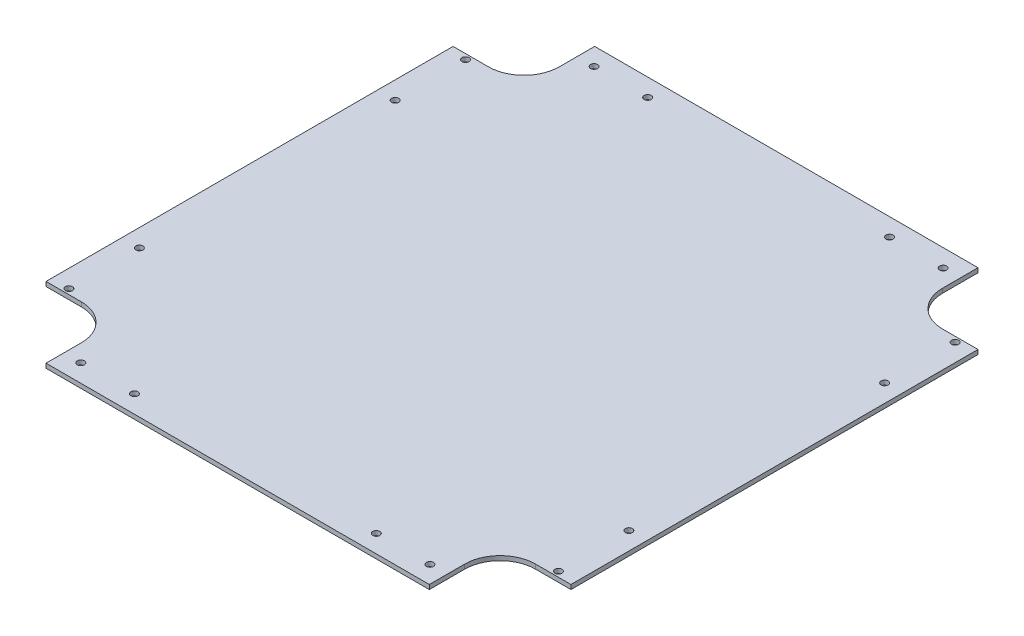
from build123d import *

# Parameters (mm, degrees)
SKETCH2_R           = 4
BOSS_EXTRUDE1_DEPTH = 5
FILLET1_R           = 40


with BuildPart() as part:
    # Sketch2 → Boss-Extrude1 (new body)
    with BuildSketch(Plane(origin=(0, -112.700994014, 0), x_dir=(1, 0, 0), z_dir=(0, 1, 0))):
        Polygon((-188.563755175, 274.737493623), (244.595772671, 274.737493623), (244.595772671, 194.737493623), (324.595772671, 194.737493623), (324.595772671, -265.262506377), (244.595772671, -265.262506377), (244.595772671, -345.262506377), (-188.563755175, -345.262506377), (-188.563755175, -265.262506377), (-268.563755175, -265.262506377), (-268.563755175, 194.737493623), (-188.563755175, 194.737493623), align=None)
        with Locations(Location((-169.208419226, 254.737493623, 0), (0, 0, 270))):
            Circle(SKETCH2_R, mode=Mode.SUBTRACT)
        with Locations(Location((-108.626011264, 254.737493623, 0), (0, 0, 270))):
            Circle(SKETCH2_R, mode=Mode.SUBTRACT)
        with Locations(Location((-248.563755175, 188.837673249, 0), (0, 0, 270))):
            Circle(SKETCH2_R, mode=Mode.SUBTRACT)
        with Locations(Location((-248.563755175, 109.252031995, 0), (0, 0, 270))):
            Circle(SKETCH2_R, mode=Mode.SUBTRACT)
        with Locations(Location((304.595772671, 109.252031995, 0), (0, 0, 90))):
            Circle(SKETCH2_R, mode=Mode.SUBTRACT)
        with Locations(Location((164.658028761, 254.737493623, 0), (0, 0, 90))):
            Circle(SKETCH2_R, mode=Mode.SUBTRACT)
        with Locations(Location((225.240436722, 254.737493623, 0), (0, 0, 90))):
            Circle(SKETCH2_R, mode=Mode.SUBTRACT)
        with Locations(Location((304.595772671, 188.837673249, 0), (0, 0, 90))):
            Circle(SKETCH2_R, mode=Mode.SUBTRACT)
        with Locations(Location((304.595772671, -259.362686002, 0), (0, 0, 270))):
            Circle(SKETCH2_R, mode=Mode.SUBTRACT)
        with Locations(Location((225.240436722, -325.262506377, 0), (0, 0, 270))):
            Circle(SKETCH2_R, mode=Mode.SUBTRACT)
        with Locations(Location((164.658028761, -325.262506377, 0), (0, 0, 270))):
            Circle(SKETCH2_R, mode=Mode.SUBTRACT)
        with Locations(Location((304.595772671, -179.777044749, 0), (0, 0, 270))):
            Circle(SKETCH2_R, mode=Mode.SUBTRACT)
        with Locations(Location((-248.563755175, -179.777044749, 0), (0, 0, 90))):
            Circle(SKETCH2_R, mode=Mode.SUBTRACT)
        with Locations(Location((-248.563755175, -259.362686002, 0), (0, 0, 90))):
            Circle(SKETCH2_R, mode=Mode.SUBTRACT)
        with Locations(Location((-108.626011264, -325.262506377, 0), (0, 0, 90))):
            Circle(SKETCH2_R, mode=Mode.SUBTRACT)
        with Locations(Location((-169.208419226, -325.262506377, 0), (0, 0, 90))):
            Circle(SKETCH2_R, mode=Mode.SUBTRACT)
    extrude(amount=BOSS_EXTRUDE1_DEPTH)

    # Fillet1
    fillet1_edges = [part.edges().sort_by_distance(p)[0] for p in [
        (244.595772671, -110.200994014, -194.737493623),
        (244.595772671, -110.200994014, 265.262506377),
        (-188.563755175, -110.200994014, 265.262506377),
        (-188.563755175, -110.200994014, -194.737493623),
    ]]
    fillet(fillet1_edges, radius=FILLET1_R)


solid = part.part
